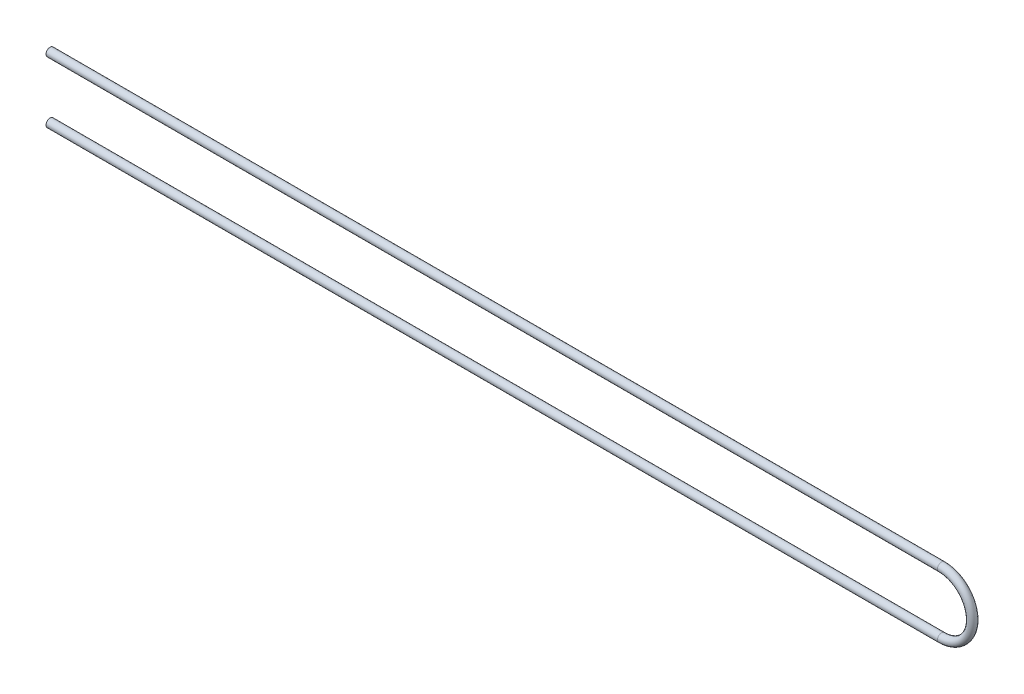
from build123d import *

# Parameters (mm, degrees)
SWEEP_THIN1_PROFILE_R   = 10.65
SWEEP_THIN1_PROFILE_R_2 = 10.15


with BuildPart() as part:
    # Sweep-Thin1: sweep along a path in Sketch1
    with BuildLine(Plane.XY) as sweep_thin1_path:
        Line((0, 0), (2325, 0))
        ThreePointArc((2325, 0), (2405, -80), (2325, -160))
        Line((2325, -160), (0, -160))
    # Sweep-Thin1 profile (on start of the path) → Sweep-Thin1 (sweep)
    with BuildSketch(Plane(origin=(0, 0, 0), x_dir=(0, 0, 1), z_dir=(1, 0, 0))):
        Circle(SWEEP_THIN1_PROFILE_R)
        Circle(SWEEP_THIN1_PROFILE_R_2, mode=Mode.SUBTRACT)
    sweep(path=sweep_thin1_path.line)


solid = part.part
